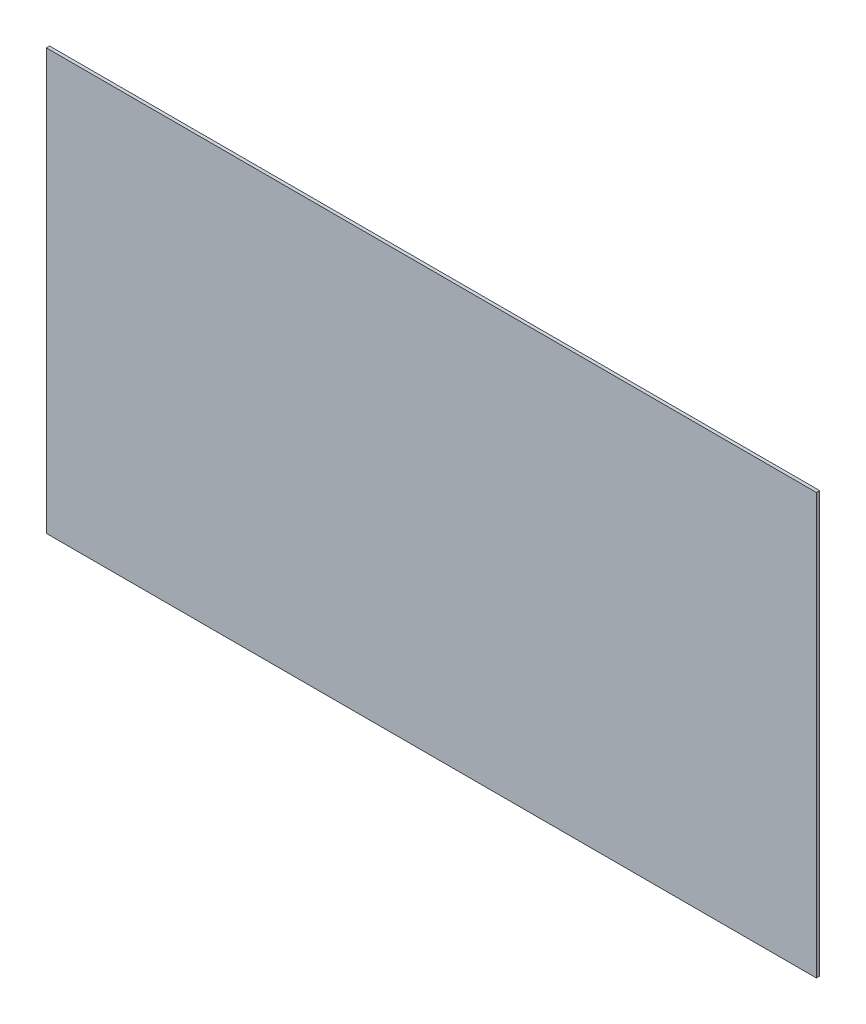
from build123d import *

# Parameters (mm, degrees)
SKETCH1_W           = 758.698
SKETCH1_H           = 414.3375
BOSS_EXTRUDE1_DEPTH = 3.175


with BuildPart() as part:
    # Sketch1 → Boss-Extrude1 (new body)
    with BuildSketch(Plane.XY):
        with Locations((-406.4, 213.51875)):
            Rectangle(SKETCH1_W, SKETCH1_H)
    extrude(amount=BOSS_EXTRUDE1_DEPTH)


solid = part.part
